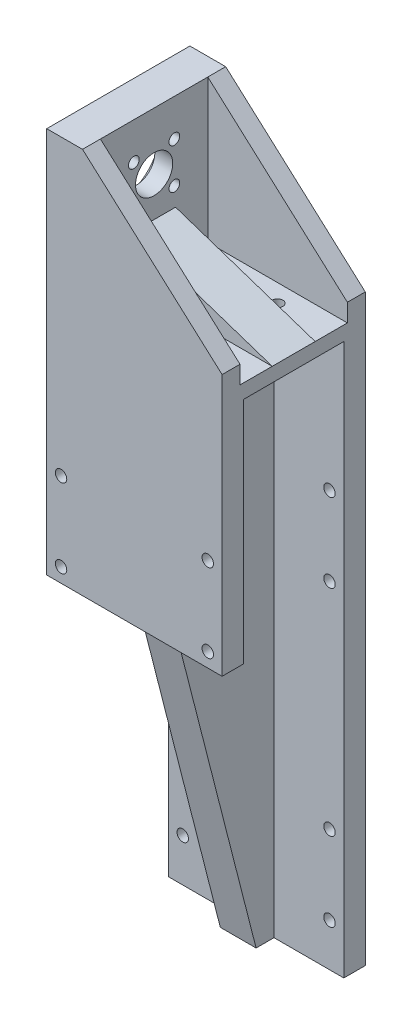
from build123d import *

# Parameters (mm, degrees)
SKETCH_1_W          = 49
SKETCH_1_H          = 40
EXTRUDE_1_DEPTH     = 4
SKETCH_2_R          = 1.5
CUT_EXTRUDE_1_DEPTH = 32.878676259
SKETCH_3_W          = 10
SKETCH_3_H          = 30
EXTRUDE_3_DEPTH     = 40
SKETCH_4_R          = 5.2
CUT_EXTRUDE_2_DEPTH = 69.82586723
SKETCH_5_R          = 11.75
CUT_EXTRUDE_3_DEPTH = 5
SKETCH_6_R          = 1.5
CUT_EXTRUDE_4_DEPTH = 66.360538553
EXTRUDE_4_DEPTH     = 6
SKETCH_8_W          = 6
SKETCH_8_H          = 64
EXTRUDE_5_DEPTH     = 49
SKETCH_9_R          = 1.6
CUT_EXTRUDE_5_DEPTH = 80.348913036
EXTRUDE_6_DEPTH     = 5
SKETCH_12_W         = 49
SKETCH_12_H         = 6
EXTRUDE_7_DEPTH     = 90
SKETCH_13_R         = 1.6
CUT_EXTRUDE_6_DEPTH = 161.985247771
EXTRUDE_8_DEPTH     = 5


with BuildPart() as part:
    # 草图1 → 凸台-拉伸1 (new body)
    with BuildSketch(Plane(origin=(0, 0, 0), x_dir=(1, 0, 0), z_dir=(0, 1, 0))):
        Rectangle(SKETCH_1_W, SKETCH_1_H)
    extrude(amount=EXTRUDE_1_DEPTH)

    # 草图2 → 切除-拉伸1 (cut, through all)
    with BuildSketch(Plane(origin=(0, 4, 0), x_dir=(1, 0, 0), z_dir=(0, 1, 0))):
        with Locations(Location((-10, 10, 0), (0, 0, 270))):
            Circle(SKETCH_2_R)
        with Locations(Location((10, 10, 0), (0, 0, 270))):
            Circle(SKETCH_2_R)
        with Locations(Location((10, -10, 0), (0, 0, 270))):
            Circle(SKETCH_2_R)
        with Locations(Location((-10, -10, 0), (0, 0, 270))):
            Circle(SKETCH_2_R)
    extrude(amount=-CUT_EXTRUDE_1_DEPTH, mode=Mode.SUBTRACT)

    # 草图3 → 凸台-拉伸3 (add)
    with BuildSketch(Plane(origin=(0, 4, 0), x_dir=(1, 0, 0), z_dir=(0, 1, 0))):
        with Locations((-19.5, 0)):
            Rectangle(SKETCH_3_W, SKETCH_3_H)
    extrude(amount=EXTRUDE_3_DEPTH)

    # 草图4 → 切除-拉伸2 (cut, through all)
    with BuildSketch(Plane.ZY.offset(24.5)):
        with Locations((0, 28)):
            Circle(SKETCH_4_R)
    extrude(amount=-CUT_EXTRUDE_2_DEPTH, mode=Mode.SUBTRACT)

    # 草图5 → 切除-拉伸3 (cut)
    with BuildSketch(Plane.ZY.offset(24.5)):
        with Locations((0, 28)):
            Circle(SKETCH_5_R)
    extrude(amount=-CUT_EXTRUDE_3_DEPTH, mode=Mode.SUBTRACT)

    # 草图6 → 切除-拉伸4 (cut, through all)
    with BuildSketch(Plane.ZY.offset(19.5)):
        with Locations((-5.656854249, 33.656854249)):
            Circle(SKETCH_6_R)
        with Locations((5.656854249, 33.656854249)):
            Circle(SKETCH_6_R)
        with Locations((5.656854249, 22.343145751)):
            Circle(SKETCH_6_R)
        with Locations((-5.656854249, 22.343145751)):
            Circle(SKETCH_6_R)
    extrude(amount=-CUT_EXTRUDE_4_DEPTH, mode=Mode.SUBTRACT)

    # 草图7 → 凸台-拉伸4 (add, symmetric)
    with BuildSketch(Plane(origin=(0, 0, 0), x_dir=(-1, 0, 0), z_dir=(0, 0, -1))):
        Polygon((14.5, 17), (-24.5, 4), (14.5, 4), align=None)
    extrude(amount=EXTRUDE_4_DEPTH, both=True)

    # 草图8 → 凸台-拉伸5 (add)
    with BuildSketch(Plane.ZY.offset(24.5)):
        with Locations((17, -32)):
            Rectangle(SKETCH_8_W, SKETCH_8_H)
        with Locations((-17, -32)):
            Rectangle(SKETCH_8_W, SKETCH_8_H)
    extrude(amount=-EXTRUDE_5_DEPTH)

    # 草图9 → 切除-拉伸5 (cut, through all)
    with BuildSketch(Plane.XY.offset(20)):
        with Locations((20.5, -60)):
            Circle(SKETCH_9_R)
        with Locations((-20.5, -60)):
            Circle(SKETCH_9_R)
        with Locations((20.5, -38)):
            Circle(SKETCH_9_R)
        with Locations((-20.5, -38)):
            Circle(SKETCH_9_R)
    extrude(amount=-CUT_EXTRUDE_5_DEPTH, mode=Mode.SUBTRACT)

    # 草图11 → 凸台-拉伸6 (add)
    with BuildSketch(Plane.XY.offset(15)):
        Polygon((-14.5, 44), (24.5, 9), (24.5, 4), (-14.5, 4), (-24.5, 4), (-24.5, 44), align=None)
    extrude_6 = extrude(amount=EXTRUDE_6_DEPTH)

    # 镜向2: 凸台-拉伸6 across plane
    add(extrude_6.mirror(Plane(origin=(0, 0, 0), x_dir=(1, 0, 0), z_dir=(0, 0, -1))))

    # 草图12 → 凸台-拉伸7 (add)
    with BuildSketch(Plane.XZ.offset(64)):
        with Locations((0, -17)):
            Rectangle(SKETCH_12_W, SKETCH_12_H)
    extrude(amount=EXTRUDE_7_DEPTH)

    # 草图13 → 切除-拉伸6 (cut, through all)
    with BuildSketch(Plane(origin=(0, 0, -20), x_dir=(-1, 0, 0), z_dir=(0, 0, -1))):
        with Locations((-20.5, -120)):
            Circle(SKETCH_13_R)
        with Locations((-20.5, -142)):
            Circle(SKETCH_13_R)
        with Locations((20.5, -120)):
            Circle(SKETCH_13_R)
        with Locations((20.5, -142)):
            Circle(SKETCH_13_R)
    extrude(amount=-CUT_EXTRUDE_6_DEPTH, mode=Mode.SUBTRACT)

    # 草图14 → 凸台-拉伸8 (add, symmetric)
    with BuildSketch(Plane(origin=(0, 0, 0), x_dir=(0, 0, -1), z_dir=(1, 0, 0))):
        Polygon((14, 0), (-14, 0), (-14, -64), (9, -154), (14, -154), (14, -64), align=None)
    extrude(amount=EXTRUDE_8_DEPTH, both=True)


solid = part.part
